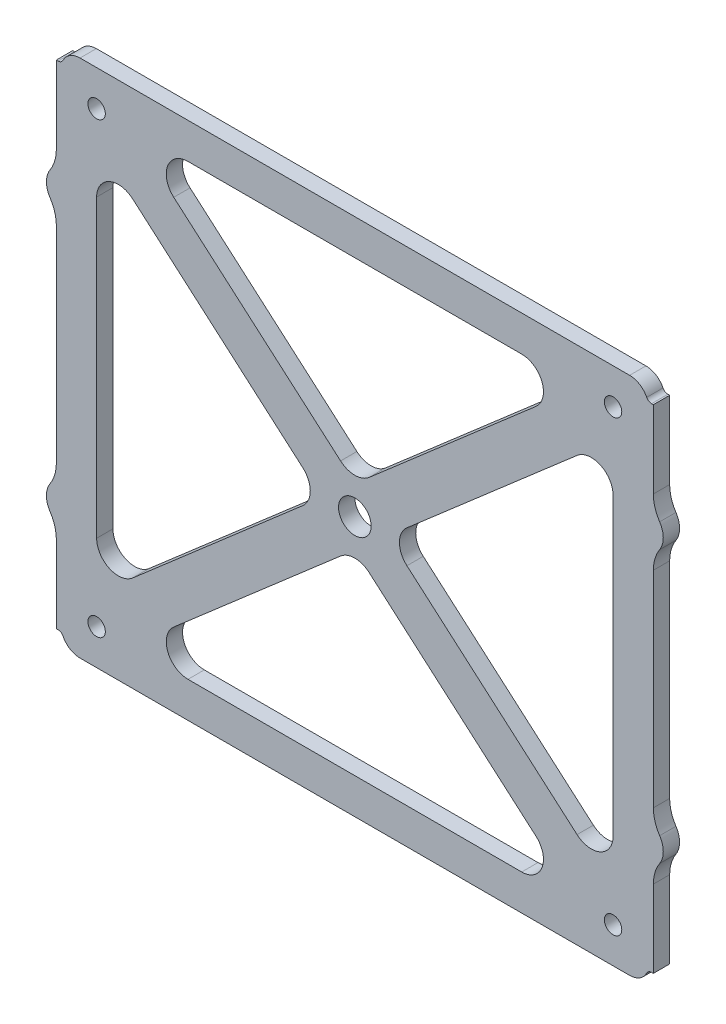
from build123d import *

# Parameters (mm, degrees)
SKETCH1_R               = 1.6
BOSS_EXTRUDE1_DEPTH     = 3
CUT_EXTRUDE1_DEPTH      = 75.246874183
CUT_EXTRUDE1_DEPTH_BACK = 75.246874183
CUT_EXTRUDE2_DEPTH      = 75.246874183
CUT_EXTRUDE2_DEPTH_BACK = 75.246874183
SKETCH4_R               = 3


with BuildPart() as part:
    # Sketch1 → Boss-Extrude1 (new body)
    with BuildSketch(Plane(origin=(0, 0, 0), x_dir=(-1, 0, 0), z_dir=(0, 0, 1))):
        with BuildLine():
            Line((-54.909101966, 18.924588491), (-54.909101966, -18.924588491))
            ThreePointArc((-54.909101966, -18.924588491), (-55.205040179, -20.938429487), (-56.067832125, -22.781992624))
            ThreePointArc((-56.067832125, -22.781992624), (-56.734101966, -25), (-56.067832125, -27.218007376))
            ThreePointArc((-56.067832125, -27.218007376), (-55.205040179, -29.061570513), (-54.909101966, -31.075411509))
            Line((-54.909101966, -31.075411509), (-54.909101966, -45.3))
            Line((-54.909101966, -45.3), (-54.581128874, -45.3))
            ThreePointArc((-54.581128874, -45.3), (-54.054082597, -45.450163414), (-53.685322458, -45.855555556))
            ThreePointArc((-53.685322458, -45.855555556), (-52.394661968, -47.27442805), (-50.55, -47.8))
            Line((-50.55, -47.8), (50.55, -47.8))
            ThreePointArc((50.55, -47.8), (52.394661968, -47.27442805), (53.685322458, -45.855555556))
            ThreePointArc((53.685322458, -45.855555556), (54.054082597, -45.450163414), (54.581128874, -45.3))
            Line((54.581128874, -45.3), (54.909101966, -45.3))
            Line((54.909101966, -45.3), (54.909101966, -31.075411509))
            ThreePointArc((54.909101966, -31.075411509), (55.205040179, -29.061570513), (56.067832125, -27.218007376))
            ThreePointArc((56.067832125, -27.218007376), (56.734101966, -25), (56.067832125, -22.781992624))
            ThreePointArc((56.067832125, -22.781992624), (55.205040179, -20.938429487), (54.909101966, -18.924588491))
            Line((54.909101966, -18.924588491), (54.909101966, 18.924588491))
            ThreePointArc((54.909101966, 18.924588491), (55.205040179, 20.938429487), (56.067832125, 22.781992624))
            ThreePointArc((56.067832125, 22.781992624), (56.734101966, 25), (56.067832125, 27.218007376))
            ThreePointArc((56.067832125, 27.218007376), (55.205040179, 29.061570513), (54.909101966, 31.075411509))
            Line((54.909101966, 31.075411509), (54.909101966, 45.3))
            Line((54.909101966, 45.3), (54.581128874, 45.3))
            ThreePointArc((54.581128874, 45.3), (54.054082597, 45.450163414), (53.685322458, 45.855555556))
            ThreePointArc((53.685322458, 45.855555556), (52.394661968, 47.27442805), (50.55, 47.8))
            Line((50.55, 47.8), (-50.55, 47.8))
            ThreePointArc((-50.55, 47.8), (-52.394661968, 47.27442805), (-53.685322458, 45.855555556))
            ThreePointArc((-53.685322458, 45.855555556), (-54.054082597, 45.450163414), (-54.581128874, 45.3))
            Line((-54.581128874, 45.3), (-54.909101966, 45.3))
            Line((-54.909101966, 45.3), (-54.909101966, 31.075411509))
            ThreePointArc((-54.909101966, 31.075411509), (-55.205040179, 29.061570513), (-56.067832125, 27.218007376))
            ThreePointArc((-56.067832125, 27.218007376), (-56.734101966, 25), (-56.067832125, 22.781992624))
            ThreePointArc((-56.067832125, 22.781992624), (-55.205040179, 20.938429487), (-54.909101966, 18.924588491))
        make_face()
        with Locations(Location((-47.5, 41.25, 0), (0, 0, 180))):
            Circle(SKETCH1_R, mode=Mode.SUBTRACT)
        with Locations(Location((-47.5, -41.25, 0), (0, 0, 180))):
            Circle(SKETCH1_R, mode=Mode.SUBTRACT)
        with Locations(Location((47.5, -41.25, 0), (0, 0, 180))):
            Circle(SKETCH1_R, mode=Mode.SUBTRACT)
        with Locations(Location((47.5, 41.25, 0), (0, 0, 180))):
            Circle(SKETCH1_R, mode=Mode.SUBTRACT)
    extrude(amount=BOSS_EXTRUDE1_DEPTH)

    # Sketch2 → Cut-Extrude1 (cut, two sides: drawn at the far end of the back side and taken through both)
    with BuildSketch(Plane.XY.offset(3).offset(-CUT_EXTRUDE1_DEPTH_BACK)):
        with BuildLine():
            Line((40.877253378, -30.200886552), (9.578203228, -3.020132474))
            ThreePointArc((9.578203228, -3.020132474), (8.200949849, 0), (9.578203228, 3.020132474))
            Line((9.578203228, 3.020132474), (40.877253378, 30.200886552))
            ThreePointArc((40.877253378, 30.200886552), (45.159670677, 30.82018992), (47.5, 27.180754078))
            Line((47.5, 27.180754078), (47.5, -27.180754078))
            ThreePointArc((47.5, -27.180754078), (45.159670677, -30.82018992), (40.877253378, -30.200886552))
        make_face()
        with BuildLine():
            Line((-33.315736166, -34.229867526), (-2.622746622, -7.575429238))
            ThreePointArc((-2.622746622, -7.575429238), (0, -6.595561711), (2.622746622, -7.575429238))
            Line((2.622746622, -7.575429238), (33.315736166, -34.229867526))
            ThreePointArc((33.315736166, -34.229867526), (34.440023698, -38.649905373), (30.692989545, -41.25))
            Line((30.692989545, -41.25), (-30.692989545, -41.25))
            ThreePointArc((-30.692989545, -41.25), (-34.440023698, -38.649905373), (-33.315736166, -34.229867526))
        make_face()
        with BuildLine():
            Line((-40.877253378, -30.200886552), (-9.578203228, -3.020132474))
            ThreePointArc((-9.578203228, -3.020132474), (-8.200949849, 0), (-9.578203228, 3.020132474))
            Line((-9.578203228, 3.020132474), (-40.877253378, 30.200886552))
            ThreePointArc((-40.877253378, 30.200886552), (-45.159670677, 30.82018992), (-47.5, 27.180754078))
            Line((-47.5, 27.180754078), (-47.5, -27.180754078))
            ThreePointArc((-47.5, -27.180754078), (-45.159670677, -30.82018992), (-40.877253378, -30.200886552))
        make_face()
        with BuildLine():
            Line((-30.692989545, 41.25), (30.692989545, 41.25))
            ThreePointArc((30.692989545, 41.25), (34.440023698, 38.649905373), (33.315736166, 34.229867526))
            Line((33.315736166, 34.229867526), (2.622746622, 7.575429238))
            ThreePointArc((2.622746622, 7.575429238), (0, 6.595561711), (-2.622746622, 7.575429238))
            Line((-2.622746622, 7.575429238), (-33.315736166, 34.229867526))
            ThreePointArc((-33.315736166, 34.229867526), (-34.440023698, 38.649905373), (-30.692989545, 41.25))
        make_face()
    extrude(amount=CUT_EXTRUDE1_DEPTH + CUT_EXTRUDE1_DEPTH_BACK, mode=Mode.SUBTRACT)

    # Sketch4 → Cut-Extrude2 (cut, two sides: drawn at the far end of the back side and taken through both)
    with BuildSketch(Plane.XY.offset(3).offset(-CUT_EXTRUDE2_DEPTH_BACK)):
        Circle(SKETCH4_R)
    extrude(amount=CUT_EXTRUDE2_DEPTH + CUT_EXTRUDE2_DEPTH_BACK, mode=Mode.SUBTRACT)


solid = part.part
